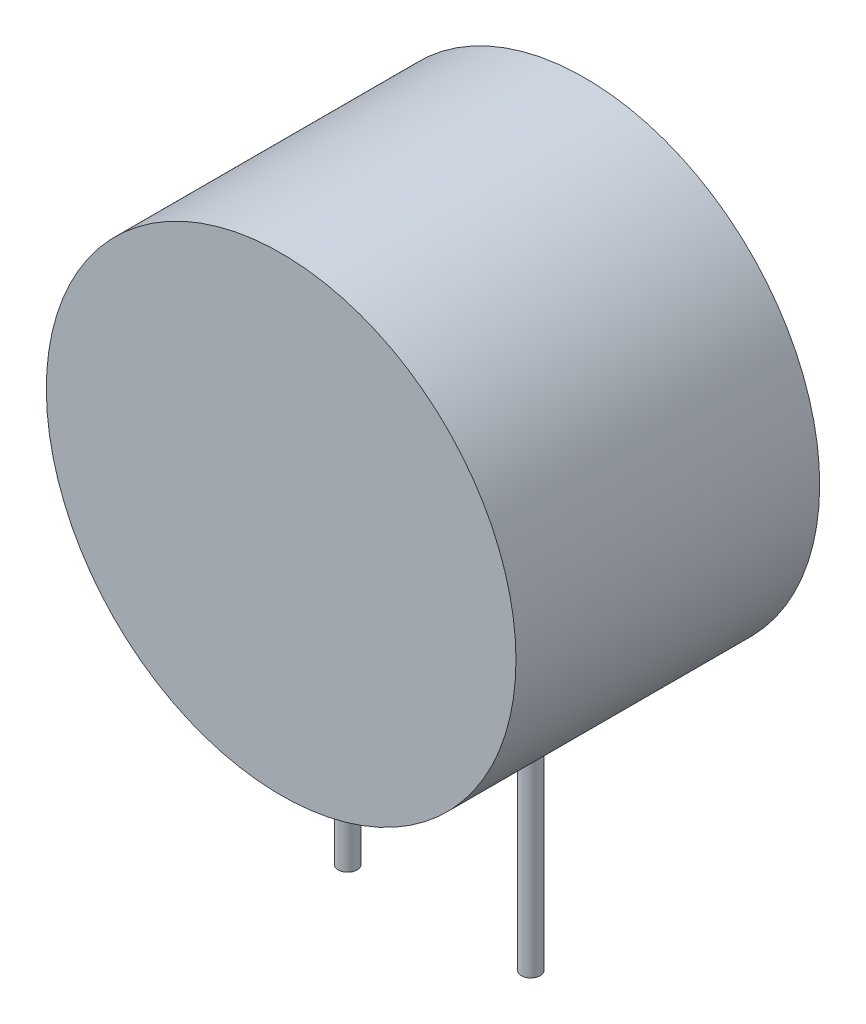
from build123d import *

# Parameters (mm, degrees)
SKETCH1_R           = 75
BOSS_EXTRUDE1_DEPTH = 97
CUT_EXTRUDE1_START  = -62.5
CUT_EXTRUDE1_DEPTH  = 62.5
SKETCH3_R           = 3
BOSS_EXTRUDE2_DEPTH = 68
BOSS_EXTRUDE3_START = 12.25
SKETCH4_W           = 37.85
SKETCH4_H           = 40
BOSS_EXTRUDE3_DEPTH = 12.25


with BuildPart() as part:
    # Sketch1 → Boss-Extrude1 (new body)
    with BuildSketch(Plane.XY):
        with Locations(Location((0, 0, 0), (0, 0, 180))):
            Circle(SKETCH1_R)
    extrude(amount=BOSS_EXTRUDE1_DEPTH)

    # Sketch2 → Cut-Extrude1 (cut)
    with BuildSketch(Plane(origin=(0, 0, 14.5), x_dir=(-1, 0, 0), z_dir=(0, 0, -1)).offset(CUT_EXTRUDE1_START)):
        Polygon((404.05546865, -66), (35.623026261, -66), (-35.623026261, -66), (-404.05546865, -66), (-404.05546865, -802.864884777), (404.05546865, -802.864884777), align=None)
    extrude(amount=CUT_EXTRUDE1_DEPTH, mode=Mode.SUBTRACT)

    # Sketch3 → Boss-Extrude2 (add)
    with BuildSketch(Plane.XZ.offset(66)):
        with Locations(Location((-29.25, 46.5, 0), (0, 0, 90))):
            Circle(SKETCH3_R)
        with Locations(Location((29.25, 46.5, 0), (0, 0, 90))):
            Circle(SKETCH3_R)
    extrude(amount=BOSS_EXTRUDE2_DEPTH)

    # Sketch4 → Boss-Extrude3 (add)
    with BuildSketch(Plane(origin=(0, 0, 0), x_dir=(-1, 0, 0), z_dir=(0, 0, -1)).offset(BOSS_EXTRUDE3_START)):
        with Locations((0, -52.573027875)):
            Rectangle(SKETCH4_W, SKETCH4_H)
        with BuildLine():
            Line((18.925, -72.573027875), (-18.925, -72.573027875))
            ThreePointArc((-18.925, -72.573027875), (0, -75), (18.925, -72.573027875))
        make_face()
    extrude(amount=-BOSS_EXTRUDE3_DEPTH)


solid = part.part
